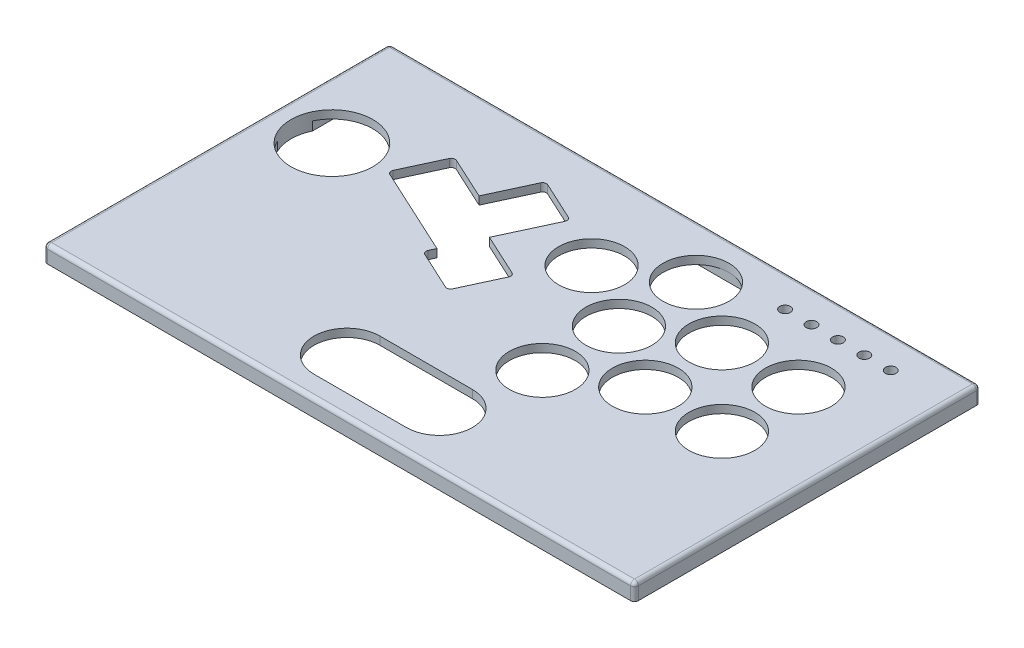
from build123d import *

# Parameters (mm, degrees)
SKETCH2_W                    = 223.798385104
SKETCH2_H                    = 130.999439424
TOP_PLATE_DEPTH              = 6.35
PRIMARY_BUTTON_CUTOUTS_REACH = 159.391
BUTTON_CUTOUTS_R             = 12.5
BUTTON_CUTOUTS_R_2           = 15.5
FILLET1_R                    = 1.5
EXTRA_BUTTONS_REACH          = 159.391
SKETCH3_R                    = 2
SKETCH4_W                    = 207.798385104
SKETCH4_H                    = 114.999439424
CUT_EXTRUDE2_DEPTH           = 3.3
SKETCH5_W                    = 14
SKETCH5_H                    = 8
CUT_EXTRUDE3_DEPTH           = 3.3
M3X0_5_TAPPED_HOLE1_D        = 2.5
M3X0_5_TAPPED_HOLE1_DEPTH    = 2.5
M3X0_5_TAPPED_HOLE1_TIP      = 0.751075774
FILLET2_R                    = 1.5


with BuildPart() as part:
    # Sketch2 → top plate (new body)
    with BuildSketch(Plane(origin=(0, 0, 0), x_dir=(1, 0, 0), z_dir=(0, 1, 0))):
        with Locations((0, 44.999719712)):
            Rectangle(SKETCH2_W, SKETCH2_H)
    extrude(amount=TOP_PLATE_DEPTH)

    # Button Cutouts → primary button cutouts (cut, up to next)
    with BuildSketch(Plane(origin=(0, 0, 0), x_dir=(1, 0, 0), z_dir=(0, 1, 0)), mode=Mode.PRIVATE) as primary_button_cutouts_sk1:
        with Locations(Location((24.5, 32, 0), (0, 0, 270))):
            Circle(BUTTON_CUTOUTS_R)
    primary_button_cutouts_tool1 = extrude(primary_button_cutouts_sk1.sketch, amount=PRIMARY_BUTTON_CUTOUTS_REACH, mode=Mode.PRIVATE) & part.part
    # Button Cutouts → primary button cutouts (cut, up to next)
    with BuildSketch(Plane(origin=(0, 0, 0), x_dir=(1, 0, 0), z_dir=(0, 1, 0)), mode=Mode.PRIVATE) as primary_button_cutouts_sk2:
        with Locations(Location((24.5, 61, 0), (0, 0, 270))):
            Circle(BUTTON_CUTOUTS_R)
    primary_button_cutouts_tool2 = extrude(primary_button_cutouts_sk2.sketch, amount=PRIMARY_BUTTON_CUTOUTS_REACH, mode=Mode.PRIVATE) & part.part
    # Button Cutouts → primary button cutouts (cut, up to next)
    with BuildSketch(Plane(origin=(0, 0, 0), x_dir=(1, 0, 0), z_dir=(0, 1, 0)), mode=Mode.PRIVATE) as primary_button_cutouts_sk3:
        with Locations(Location((49.5, 46, 0), (0, 0, 270))):
            Circle(BUTTON_CUTOUTS_R)
    primary_button_cutouts_tool3 = extrude(primary_button_cutouts_sk3.sketch, amount=PRIMARY_BUTTON_CUTOUTS_REACH, mode=Mode.PRIVATE) & part.part
    # Button Cutouts → primary button cutouts (cut, up to next)
    with BuildSketch(Plane(origin=(0, 0, 0), x_dir=(1, 0, 0), z_dir=(0, 1, 0)), mode=Mode.PRIVATE) as primary_button_cutouts_sk4:
        with Locations(Location((49.5, 75, 0), (0, 0, 270))):
            Circle(BUTTON_CUTOUTS_R)
    primary_button_cutouts_tool4 = extrude(primary_button_cutouts_sk4.sketch, amount=PRIMARY_BUTTON_CUTOUTS_REACH, mode=Mode.PRIVATE) & part.part
    # Button Cutouts → primary button cutouts (cut, up to next)
    with BuildSketch(Plane(origin=(0, 0, 0), x_dir=(1, 0, 0), z_dir=(0, 1, 0)), mode=Mode.PRIVATE) as primary_button_cutouts_sk5:
        with Locations(Location((78.5, 75, 0), (0, 0, 270))):
            Circle(BUTTON_CUTOUTS_R)
    primary_button_cutouts_tool5 = extrude(primary_button_cutouts_sk5.sketch, amount=PRIMARY_BUTTON_CUTOUTS_REACH, mode=Mode.PRIVATE) & part.part
    # Button Cutouts → primary button cutouts (cut, up to next)
    with BuildSketch(Plane(origin=(0, 0, 0), x_dir=(1, 0, 0), z_dir=(0, 1, 0)), mode=Mode.PRIVATE) as primary_button_cutouts_sk6:
        with Locations(Location((78.5, 46, 0), (0, 0, 270))):
            Circle(BUTTON_CUTOUTS_R)
    primary_button_cutouts_tool6 = extrude(primary_button_cutouts_sk6.sketch, amount=PRIMARY_BUTTON_CUTOUTS_REACH, mode=Mode.PRIVATE) & part.part
    # Button Cutouts → primary button cutouts (cut, up to next)
    with BuildSketch(Plane(origin=(0, 0, 0), x_dir=(1, 0, 0), z_dir=(0, 1, 0)), mode=Mode.PRIVATE) as primary_button_cutouts_sk7:
        with Locations(Location((-89.899192552, 66.691534373, 0), (0, 0, 270))):
            Circle(BUTTON_CUTOUTS_R_2)
    primary_button_cutouts_tool7 = extrude(primary_button_cutouts_sk7.sketch, amount=PRIMARY_BUTTON_CUTOUTS_REACH, mode=Mode.PRIVATE) & part.part
    # Button Cutouts → primary button cutouts (cut, up to next)
    with BuildSketch(Plane(origin=(0, 0, 0), x_dir=(1, 0, 0), z_dir=(0, 1, 0)), mode=Mode.PRIVATE) as primary_button_cutouts_sk8:
        with Locations(Location((24.680313923, 89.999439424, 0), (0, 0, 270))):
            Circle(BUTTON_CUTOUTS_R)
    primary_button_cutouts_tool8 = extrude(primary_button_cutouts_sk8.sketch, amount=PRIMARY_BUTTON_CUTOUTS_REACH, mode=Mode.PRIVATE) & part.part
    # Button Cutouts → primary button cutouts (cut, up to next)
    with BuildSketch(Plane(origin=(0, 0, 0), x_dir=(1, 0, 0), z_dir=(0, 1, 0)), mode=Mode.PRIVATE) as primary_button_cutouts_sk9:
        with Locations(Location((-0.524094275, 75.65587615, 0), (0, 0, 270))):
            Circle(BUTTON_CUTOUTS_R)
    primary_button_cutouts_tool9 = extrude(primary_button_cutouts_sk9.sketch, amount=PRIMARY_BUTTON_CUTOUTS_REACH, mode=Mode.PRIVATE) & part.part
    # Button Cutouts → primary button cutouts (cut, up to next)
    with BuildSketch(Plane(origin=(0, 0, 0), x_dir=(1, 0, 0), z_dir=(0, 1, 0)), mode=Mode.PRIVATE) as primary_button_cutouts_sk10:
        with BuildLine():
            Line((17.5, -12.5), (-17.5, -12.5))
            ThreePointArc((-17.5, -12.5), (-30, 0), (-17.5, 12.5))
            Line((-17.5, 12.5), (17.5, 12.5))
            ThreePointArc((17.5, 12.5), (30, 0), (17.5, -12.5))
        make_face()
    primary_button_cutouts_tool10 = extrude(primary_button_cutouts_sk10.sketch, amount=PRIMARY_BUTTON_CUTOUTS_REACH, mode=Mode.PRIVATE) & part.part
    # Button Cutouts → primary button cutouts (cut, up to next)
    with BuildSketch(Plane(origin=(0, 0, 0), x_dir=(1, 0, 0), z_dir=(0, 1, 0)), mode=Mode.PRIVATE) as primary_button_cutouts_sk11:
        Polygon((-70.006364371, 68.006025513), (-62.024315273, 85.24803503), (-44.736932046, 77.244980539), (-36.733877555, 94.532363766), (-19.491868038, 86.550314667), (-29.175353919, 65.6330347), (-11.887970692, 57.629980209), (-19.870019791, 40.387970692), (-37.112029308, 48.370019791), (-35.431597919, 51.999916531), align=None)
    primary_button_cutouts_tool11 = extrude(primary_button_cutouts_sk11.sketch, amount=PRIMARY_BUTTON_CUTOUTS_REACH, mode=Mode.PRIVATE) & part.part
    add(primary_button_cutouts_tool1.solids().sort_by_distance((24.5, 0, -32))[0], mode=Mode.SUBTRACT)
    add(primary_button_cutouts_tool2.solids().sort_by_distance((24.5, 0, -61))[0], mode=Mode.SUBTRACT)
    add(primary_button_cutouts_tool3.solids().sort_by_distance((49.5, 0, -46))[0], mode=Mode.SUBTRACT)
    add(primary_button_cutouts_tool4.solids().sort_by_distance((49.5, 0, -75))[0], mode=Mode.SUBTRACT)
    add(primary_button_cutouts_tool5.solids().sort_by_distance((78.5, 0, -75))[0], mode=Mode.SUBTRACT)
    add(primary_button_cutouts_tool6.solids().sort_by_distance((78.5, 0, -46))[0], mode=Mode.SUBTRACT)
    add(primary_button_cutouts_tool7.solids().sort_by_distance((-89.899193, 0, -66.691534))[0], mode=Mode.SUBTRACT)
    add(primary_button_cutouts_tool8.solids().sort_by_distance((24.680314, 0, -89.999439))[0], mode=Mode.SUBTRACT)
    add(primary_button_cutouts_tool9.solids().sort_by_distance((-0.524094, 0, -75.655876))[0], mode=Mode.SUBTRACT)
    add(primary_button_cutouts_tool10.solids().sort_by_distance((0, 0, 0))[0], mode=Mode.SUBTRACT)
    add(primary_button_cutouts_tool11.solids().sort_by_distance((-38.528194, 0, -68.046357))[0], mode=Mode.SUBTRACT)

    # Fillet1
    fillet1_edges = [part.edges().sort_by_distance(p)[0] for p in [
        (-19.491868038, 3.175, -86.550314667),
        (-36.733877555, 3.175, -94.532363766),
        (-62.024315273, 3.175, -85.24803503),
        (-70.006364371, 3.175, -68.006025513),
        (-37.112029308, 3.175, -48.370019791),
        (-19.870019791, 3.175, -40.387970692),
        (-11.887970692, 3.175, -57.629980209),
    ]]
    fillet(fillet1_edges, radius=FILLET1_R)

    # Sketch3 → extra buttons (cut, up to next)
    with BuildSketch(Plane(origin=(0, 6.35, 0), x_dir=(1, 0, 0), z_dir=(0, 1, 0)), mode=Mode.PRIVATE) as extra_buttons_sk1:
        with Locations(Location((50.473746808, 97.976443239, 0), (0, 0, 270))):
            Circle(SKETCH3_R)
    extra_buttons_tool1 = extrude(extra_buttons_sk1.sketch, amount=-EXTRA_BUTTONS_REACH, mode=Mode.PRIVATE) & part.part
    # Sketch3 → extra buttons (cut, up to next)
    with BuildSketch(Plane(origin=(0, 6.35, 0), x_dir=(1, 0, 0), z_dir=(0, 1, 0)), mode=Mode.PRIVATE) as extra_buttons_sk2:
        with Locations(Location((60.473746808, 97.976443239, 0), (0, 0, 270))):
            Circle(SKETCH3_R)
    extra_buttons_tool2 = extrude(extra_buttons_sk2.sketch, amount=-EXTRA_BUTTONS_REACH, mode=Mode.PRIVATE) & part.part
    # Sketch3 → extra buttons (cut, up to next)
    with BuildSketch(Plane(origin=(0, 6.35, 0), x_dir=(1, 0, 0), z_dir=(0, 1, 0)), mode=Mode.PRIVATE) as extra_buttons_sk3:
        with Locations(Location((70.473746808, 97.976443239, 0), (0, 0, 270))):
            Circle(SKETCH3_R)
    extra_buttons_tool3 = extrude(extra_buttons_sk3.sketch, amount=-EXTRA_BUTTONS_REACH, mode=Mode.PRIVATE) & part.part
    # Sketch3 → extra buttons (cut, up to next)
    with BuildSketch(Plane(origin=(0, 6.35, 0), x_dir=(1, 0, 0), z_dir=(0, 1, 0)), mode=Mode.PRIVATE) as extra_buttons_sk4:
        with Locations(Location((80.473746808, 97.976443239, 0), (0, 0, 270))):
            Circle(SKETCH3_R)
    extra_buttons_tool4 = extrude(extra_buttons_sk4.sketch, amount=-EXTRA_BUTTONS_REACH, mode=Mode.PRIVATE) & part.part
    # Sketch3 → extra buttons (cut, up to next)
    with BuildSketch(Plane(origin=(0, 6.35, 0), x_dir=(1, 0, 0), z_dir=(0, 1, 0)), mode=Mode.PRIVATE) as extra_buttons_sk5:
        with Locations(Location((90.473746808, 97.976443239, 0), (0, 0, 270))):
            Circle(SKETCH3_R)
    extra_buttons_tool5 = extrude(extra_buttons_sk5.sketch, amount=-EXTRA_BUTTONS_REACH, mode=Mode.PRIVATE) & part.part
    add(extra_buttons_tool1.solids().sort_by_distance((50.473747, 6.35, -97.976443))[0], mode=Mode.SUBTRACT)
    add(extra_buttons_tool2.solids().sort_by_distance((60.473747, 6.35, -97.976443))[0], mode=Mode.SUBTRACT)
    add(extra_buttons_tool3.solids().sort_by_distance((70.473747, 6.35, -97.976443))[0], mode=Mode.SUBTRACT)
    add(extra_buttons_tool4.solids().sort_by_distance((80.473747, 6.35, -97.976443))[0], mode=Mode.SUBTRACT)
    add(extra_buttons_tool5.solids().sort_by_distance((90.473747, 6.35, -97.976443))[0], mode=Mode.SUBTRACT)

    # Sketch4 → Cut-Extrude2 (cut)
    with BuildSketch(Plane.XZ):
        with Locations((0, -44.999719712)):
            Rectangle(SKETCH4_W, SKETCH4_H)
    extrude(amount=-CUT_EXTRUDE2_DEPTH, mode=Mode.SUBTRACT)

    # Sketch5 → Cut-Extrude3 (cut)
    with BuildSketch(Plane.XZ):
        with Locations((0, -106.499439424)):
            Rectangle(SKETCH5_W, SKETCH5_H)
    extrude(amount=-CUT_EXTRUDE3_DEPTH, mode=Mode.SUBTRACT)

    # M3x0.5 Tapped Hole1
    with Locations(Plane(origin=(-107.899192552, 0, -106.499439424), x_dir=(0, 0, -1), z_dir=(0, -1, 0))):
        with Locations((0, 0), (0, 96.899192552), (0, 118.899192552), (0, 215.798385104), (-122.999439424, 215.798385104), (-122.826484666, 107.899192552), (-122.999439424, 0)):
            Hole(M3X0_5_TAPPED_HOLE1_D / 2, depth=M3X0_5_TAPPED_HOLE1_DEPTH)
            with Locations((0, 0, -(M3X0_5_TAPPED_HOLE1_DEPTH + M3X0_5_TAPPED_HOLE1_TIP / 2))):  # 118° drill point
                Cone(0, M3X0_5_TAPPED_HOLE1_D / 2, M3X0_5_TAPPED_HOLE1_TIP, mode=Mode.SUBTRACT)

    # Fillet2
    fillet2_edges = [part.edges().sort_by_distance(p)[0] for p in [
        (111.899192552, 6.35, -44.999719712),
        (0, 6.35, -110.499439424),
        (-111.899192552, 6.35, -44.999719712),
        (-111.899192552, 3.175, -110.499439424),
        (111.899192552, 3.175, -110.499439424),
        (111.899192552, 3.175, 20.5),
        (-111.899192552, 3.175, 20.5),
        (0, 6.35, 20.5),
    ]]
    fillet(fillet2_edges, radius=FILLET2_R)


solid = part.part
